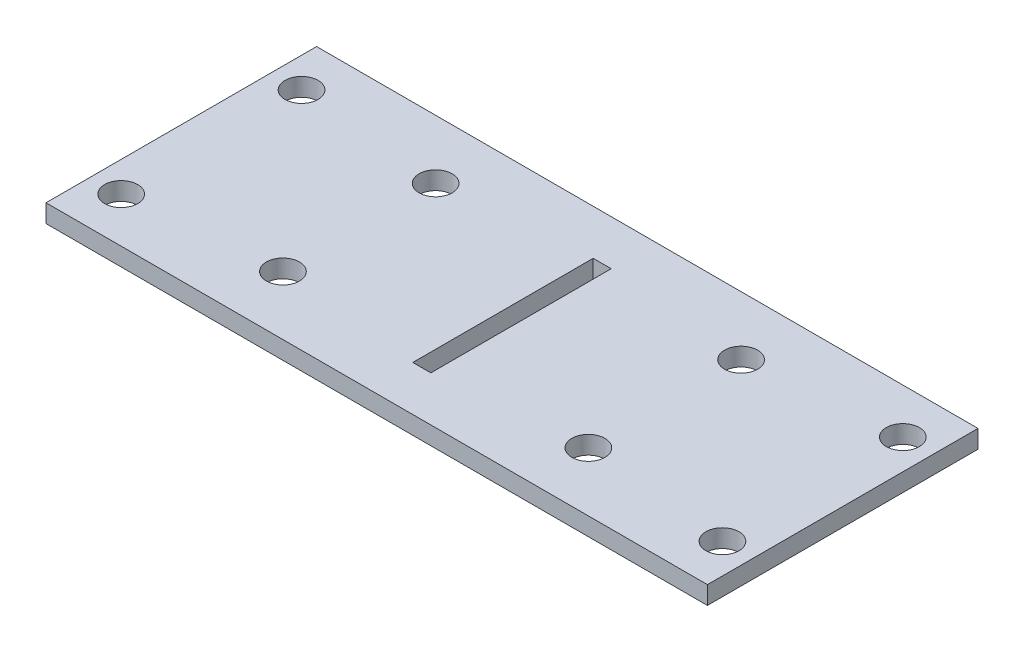
from build123d import *

# Parameters (mm, degrees)
SKETCH1_W                = 110
SKETCH1_H                = 45
SKETCH1_W_2              = 3
SKETCH1_H_2              = 30
BOSS_EXTRUDE1_DEPTH      = 3
M5_CLEARANCE_HOLE2_D     = 5.5
M5_CLEARANCE_HOLE2_DEPTH = 12.4
M5_CLEARANCE_HOLE2_TIP   = 1.652366702
M5_CLEARANCE_HOLE3_D     = 5.5


with BuildPart() as part:
    # Sketch1 → Boss-Extrude1 (new body)
    with BuildSketch(Plane(origin=(0, 0, 0), x_dir=(1, 0, 0), z_dir=(0, 1, 0))):
        Rectangle(SKETCH1_W, SKETCH1_H)
        Rectangle(SKETCH1_W_2, SKETCH1_H_2, mode=Mode.SUBTRACT)
    extrude(amount=BOSS_EXTRUDE1_DEPTH)

    # M5 Clearance Hole2
    with Locations(Plane(origin=(0, 3, 0), x_dir=(1, 0, 0), z_dir=(0, 1, 0))):
        with Locations((50, 15), (-50, -15), (-50, 15), (50, -15)):
            Hole(M5_CLEARANCE_HOLE2_D / 2, depth=M5_CLEARANCE_HOLE2_DEPTH)
            with Locations((0, 0, -(M5_CLEARANCE_HOLE2_DEPTH + M5_CLEARANCE_HOLE2_TIP / 2))):  # 118° drill point
                Cone(0, M5_CLEARANCE_HOLE2_D / 2, M5_CLEARANCE_HOLE2_TIP, mode=Mode.SUBTRACT)

    # M5 Clearance Hole3 (through all)
    with Locations(Plane(origin=(0, 3, 0), x_dir=(1, 0, 0), z_dir=(0, 1, 0))):
        with Locations((-25.4, -12.7), (25.4, 12.7), (-25.4, 12.7), (25.4, -12.7)):
            Hole(M5_CLEARANCE_HOLE3_D / 2)


solid = part.part
